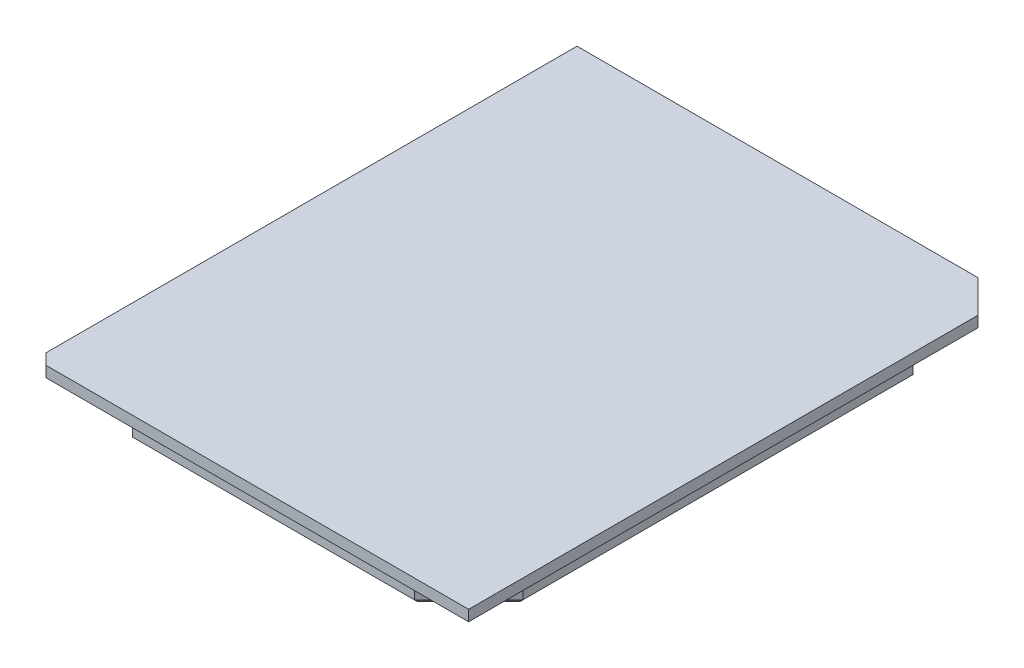
from build123d import *

# Parameters (mm, degrees)
SKETCH1_W           = 80
SKETCH1_H           = 100
BOSS_EXTRUDE1_DEPTH = 2
CHAMFER1_SIZE       = 2
CHAMFER2_SIZE       = 6
BOSS_EXTRUDE2_DEPTH = 6.5
CHAMFER3_SIZE       = 1
CHAMFER4_SIZE       = 1
FILLET1_R           = 2


with BuildPart() as part:
    # Sketch1 → Boss-Extrude1 (new body)
    with BuildSketch(Plane(origin=(0, 0, 0), x_dir=(1, 0, 0), z_dir=(0, 1, 0))):
        Rectangle(SKETCH1_W, SKETCH1_H)
    extrude(amount=BOSS_EXTRUDE1_DEPTH)

    # Chamfer1
    chamfer1_edges = [part.edges().sort_by_distance(p)[0] for p in [
        (-40, 1, 50),
    ]]
    chamfer(chamfer1_edges, length=CHAMFER1_SIZE)

    # Chamfer2
    chamfer2_edges = [part.edges().sort_by_distance(p)[0] for p in [
        (40, 1, -50),
    ]]
    chamfer(chamfer2_edges, length=CHAMFER2_SIZE)

    # Sketch3 → Boss-Extrude2 (add)
    with BuildSketch(Plane.XZ):
        Polygon((26, 46), (36, 36), (36, -36), (26, -46), (-26, -46), (-36, -36), (-36, 36), (-26, 46), align=None)
        Polygon((25.171572875, 44), (34, 35.171572875), (34, -35.171572875), (25.171572875, -44), (-25.171572875, -44), (-34, -35.171572875), (-34, 35.171572875), (-25.171572875, 44), align=None, mode=Mode.SUBTRACT)
    extrude(amount=BOSS_EXTRUDE2_DEPTH)

    # Chamfer3
    chamfer3_edges = [part.edges().sort_by_distance(p)[0] for p in [
        (0, -6.5, 46),
        (-31, -6.5, 41),
        (-36, -6.5, 0),
        (-31, -6.5, -41),
        (0, -6.5, -46),
        (31, -6.5, -41),
        (36, -6.5, 0),
        (31, -6.5, 41),
    ]]
    chamfer(chamfer3_edges, length=CHAMFER3_SIZE)

    # Chamfer4
    chamfer4_edges = [part.edges().sort_by_distance(p)[0] for p in [
        (0, 0, 46),
        (-31, 0, 41),
        (-36, 0, 0),
        (-31, 0, -41),
        (0, 0, -46),
        (31, 0, -41),
        (36, 0, 0),
        (31, 0, 41),
    ]]
    chamfer(chamfer4_edges, length=CHAMFER4_SIZE)

    # Fillet1
    fillet1_edges = [part.edges().sort_by_distance(p)[0] for p in [
        (0, 0, 44),
        (-29.585786438, 0, 39.585786438),
        (-34, 0, 0),
        (-29.585786438, 0, -39.585786438),
        (0, 0, -44),
        (29.585786438, 0, -39.585786438),
        (34, 0, 0),
        (29.585786438, 0, 39.585786438),
    ]]
    fillet(fillet1_edges, radius=FILLET1_R)


solid = part.part
